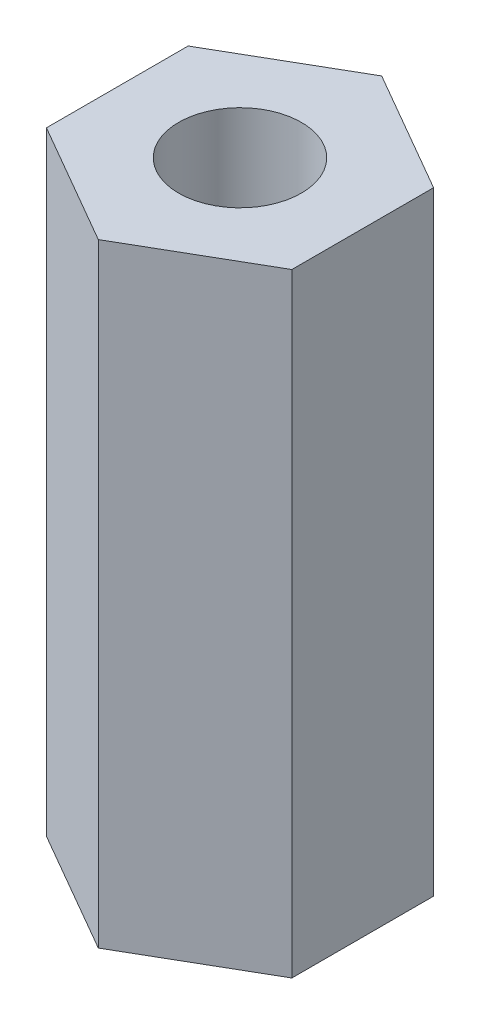
from build123d import *

# Parameters (mm, degrees)
SKETCH1_R           = 1.5
BOSS_EXTRUDE1_DEPTH = 15


with BuildPart() as part:
    # Sketch1 → Boss-Extrude1 (new body)
    with BuildSketch(Plane(origin=(0, 0, 0), x_dir=(1, 0, 0), z_dir=(0, 1, 0))):
        Polygon((0, 3.464101615), (-3, 1.732050808), (-3, -1.732050808), (0, -3.464101615), (3, -1.732050808), (3, 1.732050808), align=None)
        with Locations(Location((0, 0, 0), (0, 0, 270))):
            Circle(SKETCH1_R, mode=Mode.SUBTRACT)
    extrude(amount=BOSS_EXTRUDE1_DEPTH)


solid = part.part
